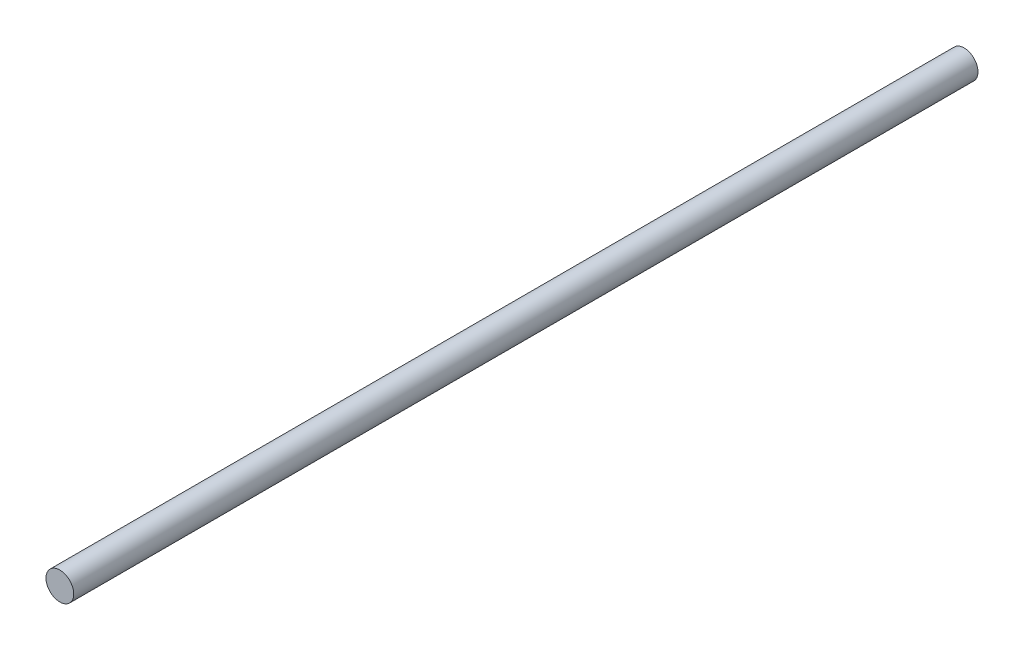
from build123d import *

# Parameters (mm, degrees)
CROQUIS1_R              = 9
SALIENTE_EXTRUIR2_DEPTH = 587


with BuildPart() as part:
    # Croquis1 → Saliente-Extruir2 (new body)
    with BuildSketch(Plane.XY):
        Circle(CROQUIS1_R)
    extrude(amount=-SALIENTE_EXTRUIR2_DEPTH)


solid = part.part
